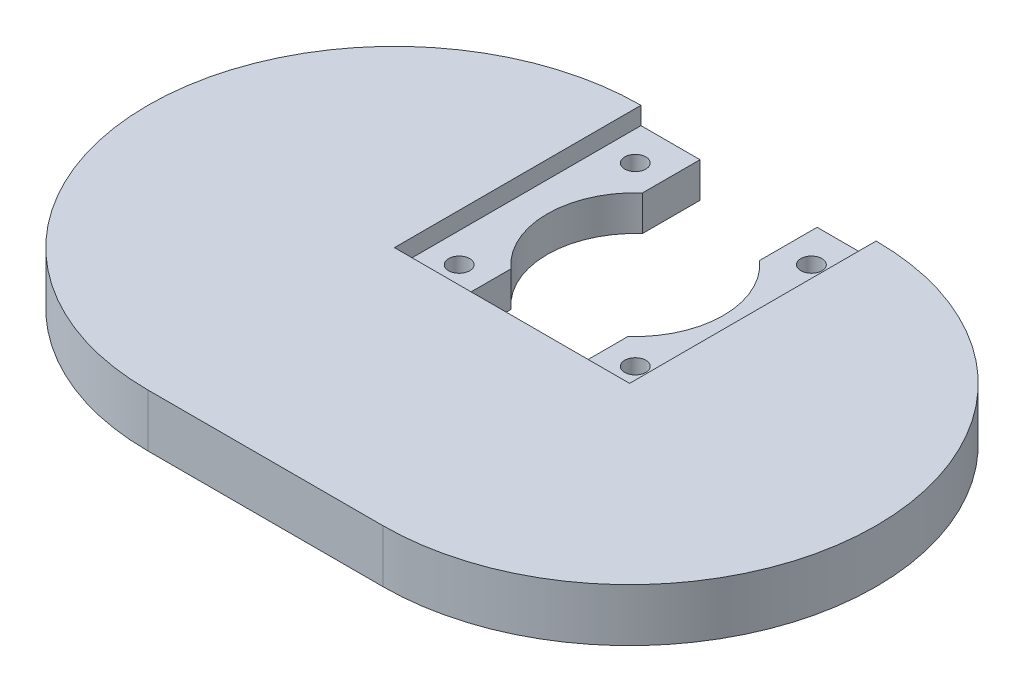
from build123d import *

# Parameters (mm, degrees)
SKETCH1_W                = 16.760563381
SKETCH1_H                = 70
BOSS_EXTRUDE1_DEPTH      = 10
SKETCH1_3_R              = 3
CUT_EXTRUDE1_DEPTH       = 20
SKETCH3_W                = 16.760563381
SKETCH3_H                = 70
SKETCH3_R                = 3
BOSS_EXTRUDE2_DEPTH      = 10
SKETCH9_R                = 24.999512183
CUT_EXTRUDE4_DEPTH       = 11
BOSS_EXTRUDE4_DEPTH      = 5
BOSS_EXTRUDE4_DEPTH_BACK = 10


with BuildPart() as part:
    # Sketch1 → Boss-Extrude1 (new body)
    with BuildSketch(Plane(origin=(0, 0, 0), x_dir=(1, 0, 0), z_dir=(0, 1, 0))):
        with Locations((-61.126760563, 24.401408451)):
            Rectangle(SKETCH1_W, SKETCH1_H)
    extrude(amount=-BOSS_EXTRUDE1_DEPTH)

    # Sketch1<3> → Cut-Extrude1 (cut)
    with BuildSketch(Plane(origin=(0, 0, 0), x_dir=(1, 0, 0), z_dir=(0, 1, 0))):
        with Locations((-61.126760563, 49.401408451)):
            Circle(SKETCH1_3_R)
        with Locations((-61.126760563, -0.598591549)):
            Circle(SKETCH1_3_R)
    extrude(amount=-CUT_EXTRUDE1_DEPTH, mode=Mode.SUBTRACT)


with BuildPart() as body_2:
    # Sketch3 → Boss-Extrude2 (new body)
    with BuildSketch(Plane(origin=(-10.44184171, 0, 0), x_dir=(1, 0, 0), z_dir=(0, 1, 0))):
        with Locations((-0.685894488, 24.401408451)):
            Rectangle(SKETCH3_W, SKETCH3_H)
        with Locations((-0.685894488, 49.401408451)):
            Circle(SKETCH3_R, mode=Mode.SUBTRACT)
        with Locations((-0.685894488, -0.598591549)):
            Circle(SKETCH3_R, mode=Mode.SUBTRACT)
    extrude(amount=-BOSS_EXTRUDE2_DEPTH)


with BuildPart() as cut_extrude4_tool:
    # Sketch9 → Cut-Extrude4 (new body)
    with BuildSketch(Plane(origin=(0, 0, 0), x_dir=(1, 0, 0), z_dir=(0, 1, 0))):
        with Locations((-36.12724838, 24.401408451)):
            Circle(SKETCH9_R)
    extrude(amount=-CUT_EXTRUDE4_DEPTH)


with BuildPart() as part_1:
    add(part.part)

    # Cut-Extrude4: cut by cut_extrude4_tool
    add(cut_extrude4_tool.part, mode=Mode.SUBTRACT)



with BuildPart() as body_2_1:
    add(body_2.part)

    # Cut-Extrude4: cut by cut_extrude4_tool
    add(cut_extrude4_tool.part, mode=Mode.SUBTRACT)


with BuildPart() as part_2:
    add(part_1.part)

    add(body_2_1.part)  # Boss-Extrude4 merges body 2
    # Sketch8 → Boss-Extrude4 (add, two sides: drawn at the far end of the back side and taken through both)
    with BuildSketch(Plane(origin=(0, 0, 0), x_dir=(1, 0, 0), z_dir=(0, 1, 0)).offset(-BOSS_EXTRUDE4_DEPTH_BACK)):
        with BuildLine():
            Line((-2.747454507, 59.401408451), (-2.747454507, -10.598591549))
            Line((-2.747454507, -10.598591549), (-19.508017888, -10.598591549))
            Line((-19.508017888, -10.598591549), (-52.746478873, -10.598591549))
            Line((-52.746478873, -10.598591549), (-69.507042254, -10.598591549))
            Line((-69.507042254, -10.598591549), (-69.507042254, 59.401408451))
            ThreePointArc((-69.507042254, 59.401408451), (-139.507042254, -10.598591549), (-69.507042254, -80.598591549))
            Line((-69.507042254, -80.598591549), (-2.747454507, -80.598591549))
            ThreePointArc((-2.747454507, -80.598591549), (67.252545493, -10.598591549), (-2.747454507, 59.401408451))
        make_face()
    extrude(amount=BOSS_EXTRUDE4_DEPTH + BOSS_EXTRUDE4_DEPTH_BACK)


solid = part_2.part
